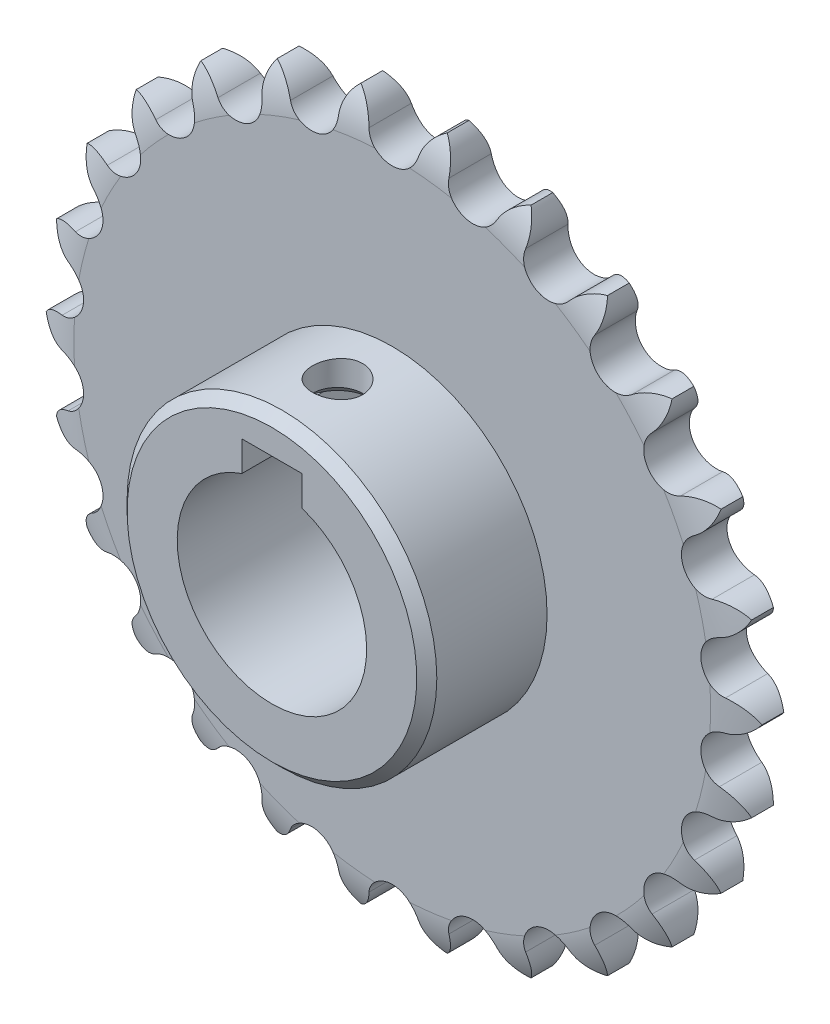
from build123d import *

# Parameters (mm, degrees)
SKETCH1_R           = 15
BOSS_EXTRUDE1_DEPTH = 7.2136
SKETCH2_W           = 19.05
SKETCH2_H           = 9.525
SKETCH3_W           = 9.525
SKETCH3_H           = 4.7625
CUT_EXTRUDE1_DEPTH  = 85.075492586
CHAMFER1_SIZE       = 1.5875


with BuildPart() as part:
    # Sketch1 → Boss-Extrude1 (new body)
    with BuildSketch(Plane.XY):
        with BuildLine():
            ThreePointArc((3.92972164, 52.414466532), (0, 49.2633), (-3.92972164, 52.414466532))
            ThreePointArc((-3.92972164, 52.414466532), (-4.963717242, 54.655608441), (-6.832202969, 56.268253799))
            ThreePointArc((-6.832202969, 56.268253799), (-8.260462601, 54.255311081), (-8.728071805, 51.831841339))
            ThreePointArc((-8.728071805, 51.831841339), (-11.789479364, 47.831798034), (-16.359133948, 49.950953449))
            ThreePointArc((-16.359133948, 49.950953449), (-17.899423881, 51.879520503), (-20.099546104, 52.998147415))
            ThreePointArc((-20.099546104, 52.998147415), (-21.004574383, 50.701892252), (-20.878621442, 48.236937928))
            ThreePointArc((-20.878621442, 48.236937928), (-22.893797041, 43.620485829), (-27.837812853, 44.584472516))
            ThreePointArc((-27.837812853, 44.584472516), (-29.794881066, 46.088383408), (-32.198776678, 46.647981344))
            ThreePointArc((-32.198776678, 46.647981344), (-32.527976651, 44.201863738), (-31.815781492, 41.838679019))
            ThreePointArc((-31.815781492, 41.838679019), (-32.66761045, 36.87410954), (-37.698659262, 36.626904099))
            ThreePointArc((-37.698659262, 36.626904099), (-39.958768064, 37.618756994), (-42.426731389, 37.586804155))
            ThreePointArc((-42.426731389, 37.586804155), (-42.16097115, 35.132983572), (-40.903923967, 33.008908163))
            ThreePointArc((-40.903923967, 33.008908163), (-40.542901081, 27.984744038), (-45.368596624, 26.540713148))
            ThreePointArc((-45.368596624, 26.540713148), (-47.800396706, 26.962865161), (-50.188998688, 26.341218532))
            ThreePointArc((-50.188998688, 26.341218532), (-49.343723254, 24.022302103), (-47.614879061, 22.260779547))
            ThreePointArc((-47.614879061, 22.260779547), (-46.061985668, 17.469006932), (-50.401876058, 14.912072421))
            ThreePointArc((-50.401876058, 14.912072421), (-52.864040038, 14.739989612), (-55.034463811, 13.564777033))
            ThreePointArc((-55.034463811, 13.564777033), (-53.658797521, 11.515531754), (-51.558630457, 10.218935338))
            ThreePointArc((-51.558630457, 10.218935338), (-48.904115077, 5.93803464), (-52.505981658, 2.416796248))
            ThreePointArc((-52.505981658, 2.416796248), (-54.855417517, 1.660479444), (-56.681525941, 0))
            ThreePointArc((-56.681525941, 0), (-54.855417517, -1.660479444), (-52.505981658, -2.416796248))
            ThreePointArc((-52.505981658, -2.416796248), (-48.904115077, -5.93803464), (-51.558630457, -10.218935338))
            ThreePointArc((-51.558630457, -10.218935338), (-53.658797521, -11.515531754), (-55.034463811, -13.564777033))
            ThreePointArc((-55.034463811, -13.564777033), (-52.864040038, -14.739989612), (-50.401876058, -14.912072421))
            ThreePointArc((-50.401876058, -14.912072421), (-46.061985668, -17.469006932), (-47.614879061, -22.260779547))
            ThreePointArc((-47.614879061, -22.260779547), (-49.343723254, -24.022302103), (-50.188998688, -26.341218532))
            ThreePointArc((-50.188998688, -26.341218532), (-47.800396706, -26.962865161), (-45.368596624, -26.540713148))
            ThreePointArc((-45.368596624, -26.540713148), (-40.542901081, -27.984744038), (-40.903923967, -33.008908163))
            ThreePointArc((-40.903923967, -33.008908163), (-42.16097115, -35.132983572), (-42.426731389, -37.586804155))
            ThreePointArc((-42.426731389, -37.586804155), (-39.958768064, -37.618756994), (-37.698659262, -36.626904099))
            ThreePointArc((-37.698659262, -36.626904099), (-32.66761045, -36.87410954), (-31.815781492, -41.838679019))
            ThreePointArc((-31.815781492, -41.838679019), (-32.527976651, -44.201863738), (-32.198776678, -46.647981344))
            ThreePointArc((-32.198776678, -46.647981344), (-29.794881066, -46.088383408), (-27.837812853, -44.584472516))
            ThreePointArc((-27.837812853, -44.584472516), (-22.893797041, -43.620485829), (-20.878621442, -48.236937928))
            ThreePointArc((-20.878621442, -48.236937928), (-21.004574383, -50.701892252), (-20.099546104, -52.998147415))
            ThreePointArc((-20.099546104, -52.998147415), (-17.899423881, -51.879520503), (-16.359133948, -49.950953449))
            ThreePointArc((-16.359133948, -49.950953449), (-11.789479364, -47.831798034), (-8.728071805, -51.831841339))
            ThreePointArc((-8.728071805, -51.831841339), (-8.260462601, -54.255311081), (-6.832202969, -56.268253799))
            ThreePointArc((-6.832202969, -56.268253799), (-4.963717242, -54.655608441), (-3.92972164, -52.414466532))
            ThreePointArc((-3.92972164, -52.414466532), (0, -49.2633), (3.92972164, -52.414466532))
            ThreePointArc((3.92972164, -52.414466532), (4.963717242, -54.655608441), (6.832202969, -56.268253799))
            ThreePointArc((6.832202969, -56.268253799), (8.260462601, -54.255311081), (8.728071805, -51.831841339))
            ThreePointArc((8.728071805, -51.831841339), (11.789479364, -47.831798034), (16.359133948, -49.950953449))
            ThreePointArc((16.359133948, -49.950953449), (17.899423881, -51.879520503), (20.099546104, -52.998147415))
            ThreePointArc((20.099546104, -52.998147415), (21.004574383, -50.701892252), (20.878621442, -48.236937928))
            ThreePointArc((20.878621442, -48.236937928), (22.893797041, -43.620485829), (27.837812853, -44.584472516))
            ThreePointArc((27.837812853, -44.584472516), (29.794881066, -46.088383408), (32.198776678, -46.647981344))
            ThreePointArc((32.198776678, -46.647981344), (32.527976651, -44.201863738), (31.815781492, -41.838679019))
            ThreePointArc((31.815781492, -41.838679019), (32.66761045, -36.87410954), (37.698659262, -36.626904099))
            ThreePointArc((37.698659262, -36.626904099), (39.958768064, -37.618756994), (42.426731389, -37.586804155))
            ThreePointArc((42.426731389, -37.586804155), (42.16097115, -35.132983572), (40.903923967, -33.008908163))
            ThreePointArc((40.903923967, -33.008908163), (40.542901081, -27.984744038), (45.368596624, -26.540713148))
            ThreePointArc((45.368596624, -26.540713148), (47.800396706, -26.962865161), (50.188998688, -26.341218532))
            ThreePointArc((50.188998688, -26.341218532), (49.343723254, -24.022302103), (47.614879061, -22.260779547))
            ThreePointArc((47.614879061, -22.260779547), (46.061985668, -17.469006932), (50.401876058, -14.912072421))
            ThreePointArc((50.401876058, -14.912072421), (52.864040038, -14.739989612), (55.034463811, -13.564777033))
            ThreePointArc((55.034463811, -13.564777033), (53.658797521, -11.515531754), (51.558630457, -10.218935338))
            ThreePointArc((51.558630457, -10.218935338), (48.904115077, -5.93803464), (52.505981658, -2.416796248))
            ThreePointArc((52.505981658, -2.416796248), (54.855417517, -1.660479444), (56.681525941, 0))
            ThreePointArc((56.681525941, 0), (54.855417517, 1.660479444), (52.505981658, 2.416796248))
            ThreePointArc((52.505981658, 2.416796248), (48.904115077, 5.93803464), (51.558630457, 10.218935338))
            ThreePointArc((51.558630457, 10.218935338), (53.658797521, 11.515531754), (55.034463811, 13.564777033))
            ThreePointArc((55.034463811, 13.564777033), (52.864040038, 14.739989612), (50.401876058, 14.912072421))
            ThreePointArc((50.401876058, 14.912072421), (46.061985668, 17.469006932), (47.614879061, 22.260779547))
            ThreePointArc((47.614879061, 22.260779547), (49.343723254, 24.022302103), (50.188998688, 26.341218532))
            ThreePointArc((50.188998688, 26.341218532), (47.800396706, 26.962865161), (45.368596624, 26.540713148))
            ThreePointArc((45.368596624, 26.540713148), (40.542901081, 27.984744038), (40.903923967, 33.008908163))
            ThreePointArc((40.903923967, 33.008908163), (42.16097115, 35.132983572), (42.426731389, 37.586804155))
            ThreePointArc((42.426731389, 37.586804155), (39.958768064, 37.618756994), (37.698659262, 36.626904099))
            ThreePointArc((37.698659262, 36.626904099), (32.66761045, 36.87410954), (31.815781492, 41.838679019))
            ThreePointArc((31.815781492, 41.838679019), (32.527976651, 44.201863738), (32.198776678, 46.647981344))
            ThreePointArc((32.198776678, 46.647981344), (29.794881066, 46.088383408), (27.837812853, 44.584472516))
            ThreePointArc((27.837812853, 44.584472516), (22.893797041, 43.620485829), (20.878621442, 48.236937928))
            ThreePointArc((20.878621442, 48.236937928), (21.004574383, 50.701892252), (20.099546104, 52.998147415))
            ThreePointArc((20.099546104, 52.998147415), (17.899423881, 51.879520503), (16.359133948, 49.950953449))
            ThreePointArc((16.359133948, 49.950953449), (11.789479364, 47.831798034), (8.728071805, 51.831841339))
            ThreePointArc((8.728071805, 51.831841339), (8.260462601, 54.255311081), (6.832202969, 56.268253799))
            ThreePointArc((6.832202969, 56.268253799), (4.963717242, 54.655608441), (3.92972164, 52.414466532))
        make_face()
        Circle(SKETCH1_R, mode=Mode.SUBTRACT)
    extrude(amount=BOSS_EXTRUDE1_DEPTH)

    # Sketch2 → Revolve1 (revolve)
    with BuildSketch(Plane(origin=(0, 0, 0), x_dir=(0, 0, -1), z_dir=(1, 0, 0))):
        with Locations((-16.7386, 19.7625)):
            Rectangle(SKETCH2_W, SKETCH2_H)
    revolve(axis=Axis((0, 0, 7.2136), (0, 0, 1)))

    # Sketch3 → Cut-Extrude1 (cut, through all)
    with BuildSketch(Plane.XY.offset(26.2636)):
        with Locations((0, 16.605124077)):
            Rectangle(SKETCH3_W, SKETCH3_H)
    extrude(amount=-CUT_EXTRUDE1_DEPTH, mode=Mode.SUBTRACT)

    # Sketch4 → 3/8-16 Tapped Hole1 (revolve, cut)
    with BuildSketch(Plane(origin=(0, 18.986374077, 15.875), x_dir=(0, 0, -1), z_dir=(1, 0, 0))):
        Polygon((0, 0), (0, 9.496665582), (3.96875, 7.112), (3.96875, 1.42875), (5.3975, 0), align=None)
    revolve(axis=Axis((0, 12.636374077, 15.875), (0, 1, 0)), mode=Mode.SUBTRACT)

    # Sketch6 → Cut-Revolve1 (revolve, cut)
    with BuildSketch(Plane(origin=(0, 0, 0), x_dir=(0, 0, -1), z_dir=(1, 0, 0))):
        with BuildLine():
            Line((-7.2136, 50.419), (-8.865762581, 50.419))
            Line((-8.865762581, 50.419), (-8.865762581, 56.896))
            Line((-8.865762581, 56.896), (-5.1943, 56.896))
            ThreePointArc((-5.1943, 56.896), (-6.644462783, 53.794836338), (-7.2136, 50.419))
        make_face()
        with BuildLine():
            Line((0, 50.419), (1.652162581, 50.419))
            Line((1.652162581, 50.419), (1.652162581, 56.896))
            Line((1.652162581, 56.896), (-2.0193, 56.896))
            ThreePointArc((-2.0193, 56.896), (-0.569137217, 53.794836338), (0, 50.419))
        make_face()
    revolve(axis=Axis((0, 0, 0), (0, 0, 1)), mode=Mode.SUBTRACT)

    # Chamfer1
    chamfer1_edges = [part.edges().sort_by_distance(p)[0] for p in [
        (0, -24.525, 26.2636),
    ]]
    chamfer(chamfer1_edges, length=CHAMFER1_SIZE)


solid = part.part
